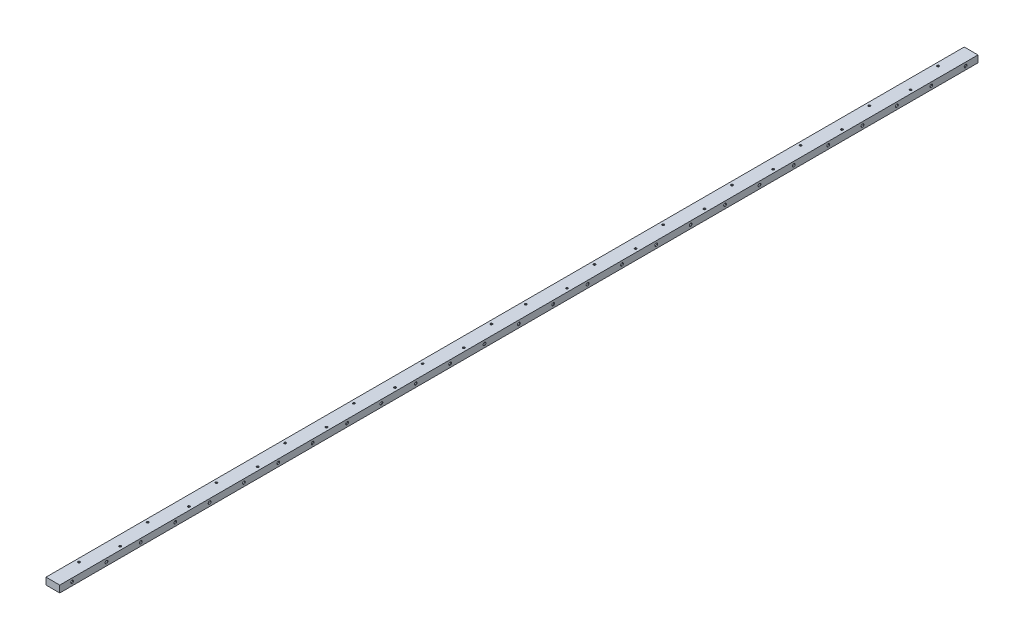
from build123d import *

# Parameters (mm, degrees)
SKETCH1_W                      = 20
SKETCH1_H                      = 10
BOSS_EXTRUDE1_DEPTH            = 668
M3X0_5_TAPPED_HOLE1_AT_2_COUNT = 2
M3X0_5_TAPPED_HOLE1_AT_2_PITCH = 50.990195136
LPATTERN1_COUNT                = 13
LPATTERN1_PITCH                = 100
LPATTERN2_COUNT                = 14
LPATTERN2_PITCH                = 50
LPATTERN2_COL_COUNT            = 14
LPATTERN2_COL_PITCH            = 50


with BuildPart() as part:
    # Sketch1 → Boss-Extrude1 (new, symmetric)
    with BuildSketch(Plane.XY):
        Rectangle(SKETCH1_W, SKETCH1_H)
    extrude(amount=BOSS_EXTRUDE1_DEPTH, both=True)

    # Sketch6 → M3x0.5 Tapped Hole1 (revolve, cut)
    with BuildSketch(Plane(origin=(-5, 5, -25), x_dir=(0, 0, 1), z_dir=(1, 0, 0))):
        Polygon((0, 0), (0, 8.751075774), (1.25, 8), (1.25, 0.724264069), (1.55, 0), align=None)
    m3x0_5_tapped_hole1 = revolve(axis=Axis((-5, 11.35, -25), (0, -1, 0)), mode=Mode.SUBTRACT)

    # M3x0.5 Tapped Hole1 at 2: M3x0.5 Tapped Hole1 ×2
    with Locations(*[Vector(0.19611613513818385, 0, -0.9805806756909202) * (i * M3X0_5_TAPPED_HOLE1_AT_2_PITCH) for i in range(1, M3X0_5_TAPPED_HOLE1_AT_2_COUNT)]):
        add(m3x0_5_tapped_hole1, mode=Mode.SUBTRACT)

    # LPattern1: M3x0.5 Tapped Hole1 ×13
    with Locations(*[(0, 0, -i * LPATTERN1_PITCH) for i in range(1, LPATTERN1_COUNT)]):
        add(m3x0_5_tapped_hole1, mode=Mode.SUBTRACT)

    # LPattern1 copy 1 sketch → LPattern1 copy 1 (revolve, cut)
    with BuildSketch(Plane(origin=(5, 5, -175), x_dir=(0, 0, 1), z_dir=(1, 0, 0))):
        Polygon((0, 0), (0, 8.751075774), (1.25, 8), (1.25, 0.724264069), (1.55, 0), align=None)
    revolve(axis=Axis((5, 11.35, -175), (0, -1, 0)), mode=Mode.SUBTRACT)

    # LPattern1 copy 2 sketch → LPattern1 copy 2 (revolve, cut)
    with BuildSketch(Plane(origin=(5, 5, -275), x_dir=(0, 0, 1), z_dir=(1, 0, 0))):
        Polygon((0, 0), (0, 8.751075774), (1.25, 8), (1.25, 0.724264069), (1.55, 0), align=None)
    revolve(axis=Axis((5, 11.35, -275), (0, -1, 0)), mode=Mode.SUBTRACT)

    # LPattern1 copy 3 sketch → LPattern1 copy 3 (revolve, cut)
    with BuildSketch(Plane(origin=(5, 5, -375), x_dir=(0, 0, 1), z_dir=(1, 0, 0))):
        Polygon((0, 0), (0, 8.751075774), (1.25, 8), (1.25, 0.724264069), (1.55, 0), align=None)
    revolve(axis=Axis((5, 11.35, -375), (0, -1, 0)), mode=Mode.SUBTRACT)

    # LPattern1 copy 4 sketch → LPattern1 copy 4 (revolve, cut)
    with BuildSketch(Plane(origin=(5, 5, -475), x_dir=(0, 0, 1), z_dir=(1, 0, 0))):
        Polygon((0, 0), (0, 8.751075774), (1.25, 8), (1.25, 0.724264069), (1.55, 0), align=None)
    revolve(axis=Axis((5, 11.35, -475), (0, -1, 0)), mode=Mode.SUBTRACT)

    # LPattern1 copy 5 sketch → LPattern1 copy 5 (revolve, cut)
    with BuildSketch(Plane(origin=(5, 5, -575), x_dir=(0, 0, 1), z_dir=(1, 0, 0))):
        Polygon((0, 0), (0, 8.751075774), (1.25, 8), (1.25, 0.724264069), (1.55, 0), align=None)
    revolve(axis=Axis((5, 11.35, -575), (0, -1, 0)), mode=Mode.SUBTRACT)

    # LPattern1 copy 6 sketch → LPattern1 copy 6 (revolve, cut)
    with BuildSketch(Plane(origin=(5, 5, -675), x_dir=(0, 0, 1), z_dir=(1, 0, 0))):
        Polygon((0, 0), (0, 8.751075774), (1.25, 8), (1.25, 0.724264069), (1.55, 0), align=None)
    revolve(axis=Axis((5, 11.35, -675), (0, -1, 0)), mode=Mode.SUBTRACT)

    # LPattern1 copy 7 sketch → LPattern1 copy 7 (revolve, cut)
    with BuildSketch(Plane(origin=(5, 5, -775), x_dir=(0, 0, 1), z_dir=(1, 0, 0))):
        Polygon((0, 0), (0, 8.751075774), (1.25, 8), (1.25, 0.724264069), (1.55, 0), align=None)
    revolve(axis=Axis((5, 11.35, -775), (0, -1, 0)), mode=Mode.SUBTRACT)

    # LPattern1 copy 8 sketch → LPattern1 copy 8 (revolve, cut)
    with BuildSketch(Plane(origin=(5, 5, -875), x_dir=(0, 0, 1), z_dir=(1, 0, 0))):
        Polygon((0, 0), (0, 8.751075774), (1.25, 8), (1.25, 0.724264069), (1.55, 0), align=None)
    revolve(axis=Axis((5, 11.35, -875), (0, -1, 0)), mode=Mode.SUBTRACT)

    # LPattern1 copy 9 sketch → LPattern1 copy 9 (revolve, cut)
    with BuildSketch(Plane(origin=(5, 5, -975), x_dir=(0, 0, 1), z_dir=(1, 0, 0))):
        Polygon((0, 0), (0, 8.751075774), (1.25, 8), (1.25, 0.724264069), (1.55, 0), align=None)
    revolve(axis=Axis((5, 11.35, -975), (0, -1, 0)), mode=Mode.SUBTRACT)

    # LPattern1 copy 10 sketch → LPattern1 copy 10 (revolve, cut)
    with BuildSketch(Plane(origin=(5, 5, -1075), x_dir=(0, 0, 1), z_dir=(1, 0, 0))):
        Polygon((0, 0), (0, 8.751075774), (1.25, 8), (1.25, 0.724264069), (1.55, 0), align=None)
    revolve(axis=Axis((5, 11.35, -1075), (0, -1, 0)), mode=Mode.SUBTRACT)

    # LPattern1 copy 11 sketch → LPattern1 copy 11 (revolve, cut)
    with BuildSketch(Plane(origin=(5, 5, -1175), x_dir=(0, 0, 1), z_dir=(1, 0, 0))):
        Polygon((0, 0), (0, 8.751075774), (1.25, 8), (1.25, 0.724264069), (1.55, 0), align=None)
    revolve(axis=Axis((5, 11.35, -1175), (0, -1, 0)), mode=Mode.SUBTRACT)

    # LPattern1 copy 12 sketch → LPattern1 copy 12 (revolve, cut)
    with BuildSketch(Plane(origin=(5, 5, -1275), x_dir=(0, 0, 1), z_dir=(1, 0, 0))):
        Polygon((0, 0), (0, 8.751075774), (1.25, 8), (1.25, 0.724264069), (1.55, 0), align=None)
    revolve(axis=Axis((5, 11.35, -1275), (0, -1, 0)), mode=Mode.SUBTRACT)

    # Sketch8 → M4x0.7 Tapped Hole1 (revolve, cut)
    with BuildSketch(Plane(origin=(10, 0, 0), x_dir=(0, 0, -1), z_dir=(0, 1, 0))):
        Polygon((0, 0), (0, 20), (2.05, 20), (1.65, 19.6), (1.65, 0.965685425), (2.05, 0), align=None)
    m4x0_7_tapped_hole1 = revolve(axis=Axis((16.35, 0, 0), (-1, 0, 0)), mode=Mode.SUBTRACT)

    # LPattern2: M4x0.7 Tapped Hole1 ×14
    with Locations(*[(0, 0, i * LPATTERN2_PITCH) for i in range(1, LPATTERN2_COUNT)]):
        add(m4x0_7_tapped_hole1, mode=Mode.SUBTRACT)

    # LPattern2 col: M4x0.7 Tapped Hole1 ×14
    with Locations(*[(0, 0, -i * LPATTERN2_COL_PITCH) for i in range(1, LPATTERN2_COL_COUNT)]):
        add(m4x0_7_tapped_hole1, mode=Mode.SUBTRACT)

    # Mirror1: M3x0.5 Tapped Hole1 across plane
    add(m3x0_5_tapped_hole1.mirror(Plane.XY), mode=Mode.SUBTRACT)

    # Mirror1 copy 1 sketch → Mirror1 copy 1 (revolve, cut)
    with BuildSketch(Plane(origin=(5, 5, 75), x_dir=(0, 0, -1), z_dir=(1, 0, 0))):
        Polygon((0, 0), (0, -8.751075774), (1.25, -8), (1.25, -0.724264069), (1.55, 0), align=None)
    revolve(axis=Axis((5, 11.35, 75), (0, 1, 0)), mode=Mode.SUBTRACT)

    # Mirror1 copy 2 sketch → Mirror1 copy 2 (revolve, cut)
    with BuildSketch(Plane(origin=(-5, 5, 125), x_dir=(0, 0, -1), z_dir=(1, 0, 0))):
        Polygon((0, 0), (0, -8.751075774), (1.25, -8), (1.25, -0.724264069), (1.55, 0), align=None)
    revolve(axis=Axis((-5, 11.35, 125), (0, 1, 0)), mode=Mode.SUBTRACT)

    # Mirror1 copy 3 sketch → Mirror1 copy 3 (revolve, cut)
    with BuildSketch(Plane(origin=(-5, 5, 225), x_dir=(0, 0, -1), z_dir=(1, 0, 0))):
        Polygon((0, 0), (0, -8.751075774), (1.25, -8), (1.25, -0.724264069), (1.55, 0), align=None)
    revolve(axis=Axis((-5, 11.35, 225), (0, 1, 0)), mode=Mode.SUBTRACT)

    # Mirror1 copy 4 sketch → Mirror1 copy 4 (revolve, cut)
    with BuildSketch(Plane(origin=(-5, 5, 325), x_dir=(0, 0, -1), z_dir=(1, 0, 0))):
        Polygon((0, 0), (0, -8.751075774), (1.25, -8), (1.25, -0.724264069), (1.55, 0), align=None)
    revolve(axis=Axis((-5, 11.35, 325), (0, 1, 0)), mode=Mode.SUBTRACT)

    # Mirror1 copy 5 sketch → Mirror1 copy 5 (revolve, cut)
    with BuildSketch(Plane(origin=(-5, 5, 425), x_dir=(0, 0, -1), z_dir=(1, 0, 0))):
        Polygon((0, 0), (0, -8.751075774), (1.25, -8), (1.25, -0.724264069), (1.55, 0), align=None)
    revolve(axis=Axis((-5, 11.35, 425), (0, 1, 0)), mode=Mode.SUBTRACT)

    # Mirror1 copy 6 sketch → Mirror1 copy 6 (revolve, cut)
    with BuildSketch(Plane(origin=(-5, 5, 525), x_dir=(0, 0, -1), z_dir=(1, 0, 0))):
        Polygon((0, 0), (0, -8.751075774), (1.25, -8), (1.25, -0.724264069), (1.55, 0), align=None)
    revolve(axis=Axis((-5, 11.35, 525), (0, 1, 0)), mode=Mode.SUBTRACT)

    # Mirror1 copy 7 sketch → Mirror1 copy 7 (revolve, cut)
    with BuildSketch(Plane(origin=(-5, 5, 625), x_dir=(0, 0, -1), z_dir=(1, 0, 0))):
        Polygon((0, 0), (0, -8.751075774), (1.25, -8), (1.25, -0.724264069), (1.55, 0), align=None)
    revolve(axis=Axis((-5, 11.35, 625), (0, 1, 0)), mode=Mode.SUBTRACT)

    # Mirror1 copy 8 sketch → Mirror1 copy 8 (revolve, cut)
    with BuildSketch(Plane(origin=(-5, 5, 725), x_dir=(0, 0, -1), z_dir=(1, 0, 0))):
        Polygon((0, 0), (0, -8.751075774), (1.25, -8), (1.25, -0.724264069), (1.55, 0), align=None)
    revolve(axis=Axis((-5, 11.35, 725), (0, 1, 0)), mode=Mode.SUBTRACT)

    # Mirror1 copy 9 sketch → Mirror1 copy 9 (revolve, cut)
    with BuildSketch(Plane(origin=(-5, 5, 825), x_dir=(0, 0, -1), z_dir=(1, 0, 0))):
        Polygon((0, 0), (0, -8.751075774), (1.25, -8), (1.25, -0.724264069), (1.55, 0), align=None)
    revolve(axis=Axis((-5, 11.35, 825), (0, 1, 0)), mode=Mode.SUBTRACT)

    # Mirror1 copy 10 sketch → Mirror1 copy 10 (revolve, cut)
    with BuildSketch(Plane(origin=(-5, 5, 925), x_dir=(0, 0, -1), z_dir=(1, 0, 0))):
        Polygon((0, 0), (0, -8.751075774), (1.25, -8), (1.25, -0.724264069), (1.55, 0), align=None)
    revolve(axis=Axis((-5, 11.35, 925), (0, 1, 0)), mode=Mode.SUBTRACT)

    # Mirror1 copy 11 sketch → Mirror1 copy 11 (revolve, cut)
    with BuildSketch(Plane(origin=(-5, 5, 1025), x_dir=(0, 0, -1), z_dir=(1, 0, 0))):
        Polygon((0, 0), (0, -8.751075774), (1.25, -8), (1.25, -0.724264069), (1.55, 0), align=None)
    revolve(axis=Axis((-5, 11.35, 1025), (0, 1, 0)), mode=Mode.SUBTRACT)

    # Mirror1 copy 12 sketch → Mirror1 copy 12 (revolve, cut)
    with BuildSketch(Plane(origin=(-5, 5, 1125), x_dir=(0, 0, -1), z_dir=(1, 0, 0))):
        Polygon((0, 0), (0, -8.751075774), (1.25, -8), (1.25, -0.724264069), (1.55, 0), align=None)
    revolve(axis=Axis((-5, 11.35, 1125), (0, 1, 0)), mode=Mode.SUBTRACT)

    # Mirror1 copy 13 sketch → Mirror1 copy 13 (revolve, cut)
    with BuildSketch(Plane(origin=(-5, 5, 1225), x_dir=(0, 0, -1), z_dir=(1, 0, 0))):
        Polygon((0, 0), (0, -8.751075774), (1.25, -8), (1.25, -0.724264069), (1.55, 0), align=None)
    revolve(axis=Axis((-5, 11.35, 1225), (0, 1, 0)), mode=Mode.SUBTRACT)

    # Mirror1 copy 14 sketch → Mirror1 copy 14 (revolve, cut)
    with BuildSketch(Plane(origin=(5, 5, 175), x_dir=(0, 0, -1), z_dir=(1, 0, 0))):
        Polygon((0, 0), (0, -8.751075774), (1.25, -8), (1.25, -0.724264069), (1.55, 0), align=None)
    revolve(axis=Axis((5, 11.35, 175), (0, 1, 0)), mode=Mode.SUBTRACT)

    # Mirror1 copy 15 sketch → Mirror1 copy 15 (revolve, cut)
    with BuildSketch(Plane(origin=(5, 5, 275), x_dir=(0, 0, -1), z_dir=(1, 0, 0))):
        Polygon((0, 0), (0, -8.751075774), (1.25, -8), (1.25, -0.724264069), (1.55, 0), align=None)
    revolve(axis=Axis((5, 11.35, 275), (0, 1, 0)), mode=Mode.SUBTRACT)

    # Mirror1 copy 16 sketch → Mirror1 copy 16 (revolve, cut)
    with BuildSketch(Plane(origin=(5, 5, 375), x_dir=(0, 0, -1), z_dir=(1, 0, 0))):
        Polygon((0, 0), (0, -8.751075774), (1.25, -8), (1.25, -0.724264069), (1.55, 0), align=None)
    revolve(axis=Axis((5, 11.35, 375), (0, 1, 0)), mode=Mode.SUBTRACT)

    # Mirror1 copy 17 sketch → Mirror1 copy 17 (revolve, cut)
    with BuildSketch(Plane(origin=(5, 5, 475), x_dir=(0, 0, -1), z_dir=(1, 0, 0))):
        Polygon((0, 0), (0, -8.751075774), (1.25, -8), (1.25, -0.724264069), (1.55, 0), align=None)
    revolve(axis=Axis((5, 11.35, 475), (0, 1, 0)), mode=Mode.SUBTRACT)

    # Mirror1 copy 18 sketch → Mirror1 copy 18 (revolve, cut)
    with BuildSketch(Plane(origin=(5, 5, 575), x_dir=(0, 0, -1), z_dir=(1, 0, 0))):
        Polygon((0, 0), (0, -8.751075774), (1.25, -8), (1.25, -0.724264069), (1.55, 0), align=None)
    revolve(axis=Axis((5, 11.35, 575), (0, 1, 0)), mode=Mode.SUBTRACT)

    # Mirror1 copy 19 sketch → Mirror1 copy 19 (revolve, cut)
    with BuildSketch(Plane(origin=(5, 5, 675), x_dir=(0, 0, -1), z_dir=(1, 0, 0))):
        Polygon((0, 0), (0, -8.751075774), (1.25, -8), (1.25, -0.724264069), (1.55, 0), align=None)
    revolve(axis=Axis((5, 11.35, 675), (0, 1, 0)), mode=Mode.SUBTRACT)

    # Mirror1 copy 20 sketch → Mirror1 copy 20 (revolve, cut)
    with BuildSketch(Plane(origin=(5, 5, 775), x_dir=(0, 0, -1), z_dir=(1, 0, 0))):
        Polygon((0, 0), (0, -8.751075774), (1.25, -8), (1.25, -0.724264069), (1.55, 0), align=None)
    revolve(axis=Axis((5, 11.35, 775), (0, 1, 0)), mode=Mode.SUBTRACT)

    # Mirror1 copy 21 sketch → Mirror1 copy 21 (revolve, cut)
    with BuildSketch(Plane(origin=(5, 5, 875), x_dir=(0, 0, -1), z_dir=(1, 0, 0))):
        Polygon((0, 0), (0, -8.751075774), (1.25, -8), (1.25, -0.724264069), (1.55, 0), align=None)
    revolve(axis=Axis((5, 11.35, 875), (0, 1, 0)), mode=Mode.SUBTRACT)

    # Mirror1 copy 22 sketch → Mirror1 copy 22 (revolve, cut)
    with BuildSketch(Plane(origin=(5, 5, 975), x_dir=(0, 0, -1), z_dir=(1, 0, 0))):
        Polygon((0, 0), (0, -8.751075774), (1.25, -8), (1.25, -0.724264069), (1.55, 0), align=None)
    revolve(axis=Axis((5, 11.35, 975), (0, 1, 0)), mode=Mode.SUBTRACT)

    # Mirror1 copy 23 sketch → Mirror1 copy 23 (revolve, cut)
    with BuildSketch(Plane(origin=(5, 5, 1075), x_dir=(0, 0, -1), z_dir=(1, 0, 0))):
        Polygon((0, 0), (0, -8.751075774), (1.25, -8), (1.25, -0.724264069), (1.55, 0), align=None)
    revolve(axis=Axis((5, 11.35, 1075), (0, 1, 0)), mode=Mode.SUBTRACT)

    # Mirror1 copy 24 sketch → Mirror1 copy 24 (revolve, cut)
    with BuildSketch(Plane(origin=(5, 5, 1175), x_dir=(0, 0, -1), z_dir=(1, 0, 0))):
        Polygon((0, 0), (0, -8.751075774), (1.25, -8), (1.25, -0.724264069), (1.55, 0), align=None)
    revolve(axis=Axis((5, 11.35, 1175), (0, 1, 0)), mode=Mode.SUBTRACT)

    # Mirror1 copy 25 sketch → Mirror1 copy 25 (revolve, cut)
    with BuildSketch(Plane(origin=(5, 5, 1275), x_dir=(0, 0, -1), z_dir=(1, 0, 0))):
        Polygon((0, 0), (0, -8.751075774), (1.25, -8), (1.25, -0.724264069), (1.55, 0), align=None)
    revolve(axis=Axis((5, 11.35, 1275), (0, 1, 0)), mode=Mode.SUBTRACT)


solid = part.part
